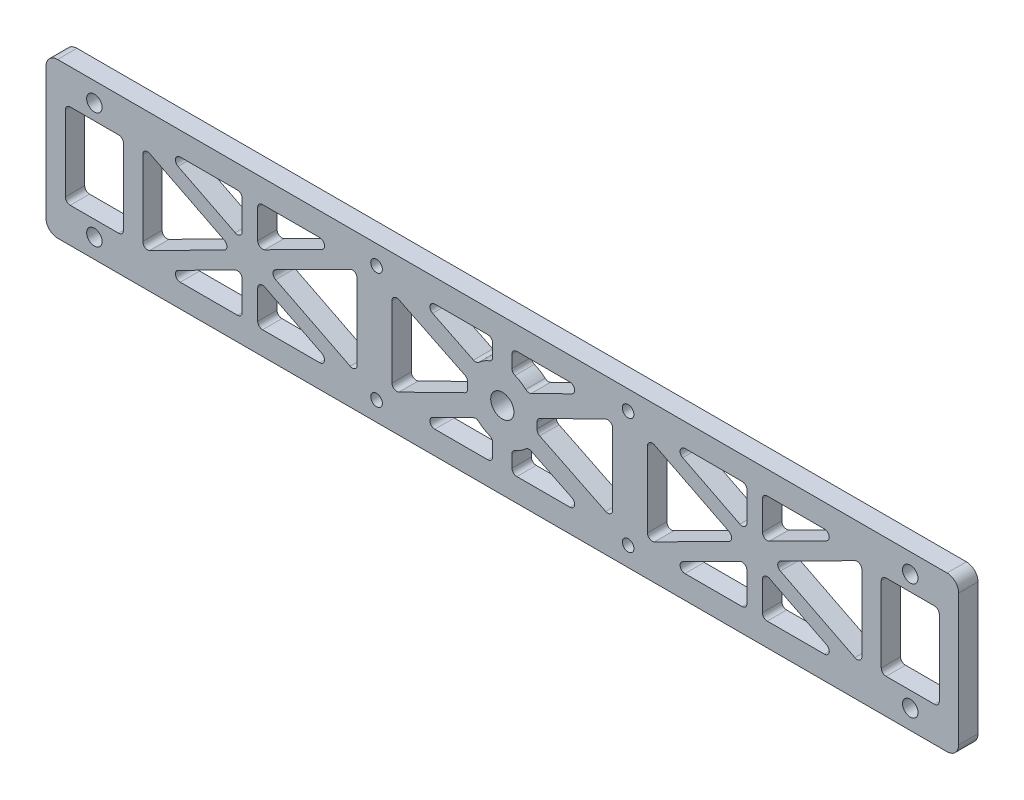
from build123d import *

# Parameters (mm, degrees)
SKETCH_1_W          = 235.8
SKETCH_1_H          = 40
EXTRUDE_1_DEPTH     = 5
SKETCH_2_R          = 3
CUT_EXTRUDE_1_DEPTH = 10
FILLET_1_R          = 3
SKETCH_3_R          = 1.5
CUT_EXTRUDE_2_DEPTH = 5
SKETCH_5_R          = 2
CUT_EXTRUDE_3_DEPTH = 5
SKETCH_6_W          = 55.4
SKETCH_6_H          = 28
CUT_EXTRUDE_4_DEPTH = 5
EXTRUDE_2_DEPTH     = 5
SKETCH_8_W          = 15
SKETCH_8_H          = 22
CUT_EXTRUDE_5_DEPTH = 5
SKETCH_9_W          = 57
SKETCH_9_H          = 28
SKETCH_9_R          = 9
CUT_EXTRUDE_6_DEPTH = 5
EXTRUDE_3_DEPTH     = 5
EXTRUDE_4_DEPTH     = 5
FILLET_2_R          = 1.25


with BuildPart() as part:
    # 草图1 → 凸台-拉伸1 (new body)
    with BuildSketch(Plane.XY):
        Rectangle(SKETCH_1_W, SKETCH_1_H)
    extrude(amount=EXTRUDE_1_DEPTH)

    # 草图2 → 切除-拉伸1 (cut)
    with BuildSketch(Plane.XY.offset(5)):
        Circle(SKETCH_2_R)
    extrude(amount=-CUT_EXTRUDE_1_DEPTH, mode=Mode.SUBTRACT)

    # 圆角1
    fillet_1_edges = [part.edges().sort_by_distance(p)[0] for p in [
        (117.9, -20, 2.5),
        (-117.9, -20, 2.5),
        (-117.9, 20, 2.5),
        (117.9, 20, 2.5),
    ]]
    fillet(fillet_1_edges, radius=FILLET_1_R)

    # 草图3 → 切除-拉伸2 (cut)
    with BuildSketch(Plane(origin=(0, 0, 0), x_dir=(-1, 0, 0), z_dir=(0, 0, -1))):
        with Locations((-32.5, -15)):
            Circle(SKETCH_3_R)
        with Locations((-32.5, 15)):
            Circle(SKETCH_3_R)
        with Locations((32.5, 15)):
            Circle(SKETCH_3_R)
        with Locations((32.5, -15)):
            Circle(SKETCH_3_R)
    extrude(amount=-CUT_EXTRUDE_2_DEPTH, mode=Mode.SUBTRACT)

    # 草图5 → 切除-拉伸3 (cut)
    with BuildSketch(Plane(origin=(0, 0, 0), x_dir=(-1, 0, 0), z_dir=(0, 0, -1))):
        with Locations((-105.4, -15)):
            Circle(SKETCH_5_R)
        with Locations((-105.4, 15)):
            Circle(SKETCH_5_R)
        with Locations((105.4, 15)):
            Circle(SKETCH_5_R)
        with Locations((105.4, -15)):
            Circle(SKETCH_5_R)
    extrude(amount=-CUT_EXTRUDE_3_DEPTH, mode=Mode.SUBTRACT)

    # 草图6 → 切除-拉伸4 (cut)
    with BuildSketch(Plane(origin=(0, 0, 0), x_dir=(-1, 0, 0), z_dir=(0, 0, -1))):
        with Locations((-65.2, 0)):
            Rectangle(SKETCH_6_W, SKETCH_6_H)
    cut_extrude_4 = extrude(amount=-CUT_EXTRUDE_4_DEPTH, mode=Mode.SUBTRACT)

    # 草图7 → 凸台-拉伸2 (add)
    with BuildSketch(Plane(origin=(0, 0, 0), x_dir=(-1, 0, 0), z_dir=(0, 0, -1))):
        Polygon((-93.802151562, 12.215028695), (-69.633844787, 0), (-93.802151562, -12.215028695), (-91.997848438, -15.784971305), (-67.2, -3.251762708), (-67.2, -14), (-63.2, -14), (-63.2, -3.251762708), (-38.402151562, -15.784971305), (-36.597848438, -12.215028695), (-60.766155213, 0), (-36.597848438, 12.215028695), (-38.402151562, 15.784971305), (-63.2, 3.251762708), (-63.2, 14), (-67.2, 14), (-67.2, 3.251762708), (-91.997848438, 15.784971305), align=None)
    extrude_2 = extrude(amount=-EXTRUDE_2_DEPTH)

    # 镜向1: 切除-拉伸4, 凸台-拉伸2 across plane
    add(cut_extrude_4.mirror(Plane(origin=(0, 0, 0), x_dir=(0, 0, 1), z_dir=(1, 0, 0))), mode=Mode.SUBTRACT)
    add(extrude_2.mirror(Plane(origin=(0, 0, 0), x_dir=(0, 0, 1), z_dir=(1, 0, 0))))

    # 草图8 → 切除-拉伸5 (cut)
    with BuildSketch(Plane(origin=(0, 0, 0), x_dir=(-1, 0, 0), z_dir=(0, 0, -1))):
        with Locations((-105.4, 0)):
            Rectangle(SKETCH_8_W, SKETCH_8_H)
    cut_extrude_5 = extrude(amount=-CUT_EXTRUDE_5_DEPTH, mode=Mode.SUBTRACT)

    # 镜向2: 切除-拉伸5 across plane
    add(cut_extrude_5.mirror(Plane(origin=(0, 0, 0), x_dir=(0, 0, 1), z_dir=(1, 0, 0))), mode=Mode.SUBTRACT)

    # 草图9 → 切除-拉伸6 (cut)
    with BuildSketch(Plane(origin=(0, 0, 0), x_dir=(-1, 0, 0), z_dir=(0, 0, -1))):
        Rectangle(SKETCH_9_W, SKETCH_9_H)
        Circle(SKETCH_9_R, mode=Mode.SUBTRACT)
    extrude(amount=-CUT_EXTRUDE_6_DEPTH, mode=Mode.SUBTRACT)


with BuildPart() as cut_extrude_6_piece_1:
    # of the separate pieces the step leaves, piece 1, a body of its own (cut_extrude_6_pieces)
    add(part.part.solids().sort_by_distance((-114.9, -20, 0))[0])



with BuildPart() as cut_extrude_6_piece_2:
    # of the separate pieces the step leaves, piece 2, a body of its own (cut_extrude_6_pieces)
    add(part.part.solids().sort_by_distance((-9, 0, 0))[0])


with BuildPart() as cut_extrude_6_piece_1_1:
    add(cut_extrude_6_piece_1.part)

    add(cut_extrude_6_piece_2.part)  # 凸台-拉伸3 merges 切除-拉伸6 piece 2
    # 草图10 → 凸台-拉伸3 (add)
    with BuildSketch(Plane(origin=(0, 0, 0), x_dir=(-1, 0, 0), z_dir=(0, 0, -1))):
        with BuildLine():
            Line((-2.5, 14), (-2.5, 8.645808233))
            ThreePointArc((-2.5, 8.645808233), (0, 9), (2.5, 8.645808233))
            Line((2.5, 8.645808233), (2.5, 14))
            Line((2.5, 14), (-2.5, 14))
        make_face()
        with BuildLine():
            Line((-2.5, -8.645808233), (-2.5, -14))
            Line((-2.5, -14), (2.5, -14))
            Line((2.5, -14), (2.5, -8.645808233))
            ThreePointArc((2.5, -8.645808233), (0, -9), (-2.5, -8.645808233))
        make_face()
    extrude(amount=-EXTRUDE_3_DEPTH)

    # 草图11 → 凸台-拉伸4 (add)
    with BuildSketch(Plane(origin=(0, 0, 0), x_dir=(-1, 0, 0), z_dir=(0, 0, -1))):
        with BuildLine():
            Line((-27.397740301, 16.243885816), (-29.602259699, 11.756114184))
            Line((-29.602259699, 11.756114184), (-8.862342284, 1.568084577))
            ThreePointArc((-8.862342284, 1.568084577), (-8.077988938, 3.968134917), (-6.657822886, 6.055856209))
            Line((-6.657822886, 6.055856209), (-27.397740301, 16.243885816))
        make_face()
        with BuildLine():
            ThreePointArc((-6.657822886, -6.055856209), (-8.077988938, -3.968134917), (-8.862342284, -1.568084577))
            Line((-8.862342284, -1.568084577), (-29.602259699, -11.756114184))
            Line((-29.602259699, -11.756114184), (-27.397740301, -16.243885816))
            Line((-27.397740301, -16.243885816), (-6.657822886, -6.055856209))
        make_face()
        with BuildLine():
            ThreePointArc((8.862342284, -1.568084577), (8.077988938, -3.968134917), (6.657822886, -6.055856209))
            Line((6.657822886, -6.055856209), (27.397740301, -16.243885816))
            Line((27.397740301, -16.243885816), (29.602259699, -11.756114184))
            Line((29.602259699, -11.756114184), (8.862342284, -1.568084577))
        make_face()
        with BuildLine():
            Line((27.397740301, 16.243885816), (6.657822886, 6.055856209))
            ThreePointArc((6.657822886, 6.055856209), (8.077988938, 3.968134917), (8.862342284, 1.568084577))
            Line((8.862342284, 1.568084577), (29.602259699, 11.756114184))
            Line((29.602259699, 11.756114184), (27.397740301, 16.243885816))
        make_face()
    extrude(amount=-EXTRUDE_4_DEPTH)

    # 圆角2
    fillet_2_edges = [cut_extrude_6_piece_1_1.edges().sort_by_distance(p)[0] for p in [
        (-2.5, 8.645808233, 2.5),
        (2.5, 8.645808233, 2.5),
        (2.5, 14, 2.5),
        (-2.5, 14, 2.5),
        (37.5, 11.759067617, 2.5),
        (37.5, -11.759067617, 2.5),
        (88.466155213, -14, 2.5),
        (92.9, -11.759067617, 2.5),
        (92.9, 11.759067617, 2.5),
        (2.5, -14, 2.5),
        (-2.5, -14, 2.5),
        (-2.5, -8.645808233, 2.5),
        (2.5, -8.645808233, 2.5),
        (41.933844787, 14, 2.5),
        (60.766155213, 0, 2.5),
        (67.2, -3.251762708, 2.5),
        (69.633844787, 0, 2.5),
        (63.2, 3.251762708, 2.5),
        (67.2, 3.251762708, 2.5),
        (63.2, 14, 2.5),
        (63.2, -3.251762708, 2.5),
        (67.2, -14, 2.5),
        (28.5, 11.214653279, 2.5),
        (-67.2, 3.251762708, 2.5),
        (-67.2, 14, 2.5),
        (-63.2, 3.251762708, 2.5),
        (22.82982989, 14, 2.5),
        (8.862342284, 1.568084577, 2.5),
        (-60.766155213, 0, 2.5),
        (6.657822886, 6.055856209, 2.5),
        (-63.2, -3.251762708, 2.5),
        (-63.2, -14, 2.5),
        (-67.2, -3.251762708, 2.5),
        (28.5, -11.214653279, 2.5),
        (-69.633844787, 0, 2.5),
        (97.9, -11, 2.5),
        (6.657822886, -6.055856209, 2.5),
        (112.9, -11, 2.5),
        (22.82982989, -14, 2.5),
        (8.862342284, -1.568084577, 2.5),
        (112.9, 11, 2.5),
        (97.9, 11, 2.5),
        (-97.9, -11, 2.5),
        (-112.9, -11, 2.5),
        (-112.9, 11, 2.5),
        (-97.9, 11, 2.5),
        (-28.5, -11.214653279, 2.5),
        (-8.862342284, -1.568084577, 2.5),
        (-6.657822886, -6.055856209, 2.5),
        (-22.82982989, -14, 2.5),
        (-22.82982989, 14, 2.5),
        (-6.657822886, 6.055856209, 2.5),
        (-8.862342284, 1.568084577, 2.5),
        (-28.5, 11.214653279, 2.5),
        (-41.933844787, -14, 2.5),
        (-67.2, -14, 2.5),
        (-88.466155213, -14, 2.5),
        (-92.9, -11.759067617, 2.5),
        (-92.9, 11.759067617, 2.5),
        (-88.466155213, 14, 2.5),
        (-63.2, 14, 2.5),
        (-41.933844787, 14, 2.5),
        (-37.5, 11.759067617, 2.5),
        (-37.5, -11.759067617, 2.5),
        (41.933844787, -14, 2.5),
        (63.2, -14, 2.5),
        (88.466155213, 14, 2.5),
        (67.2, 14, 2.5),
    ]]
    fillet(fillet_2_edges, radius=FILLET_2_R)


solid = cut_extrude_6_piece_1_1.part
